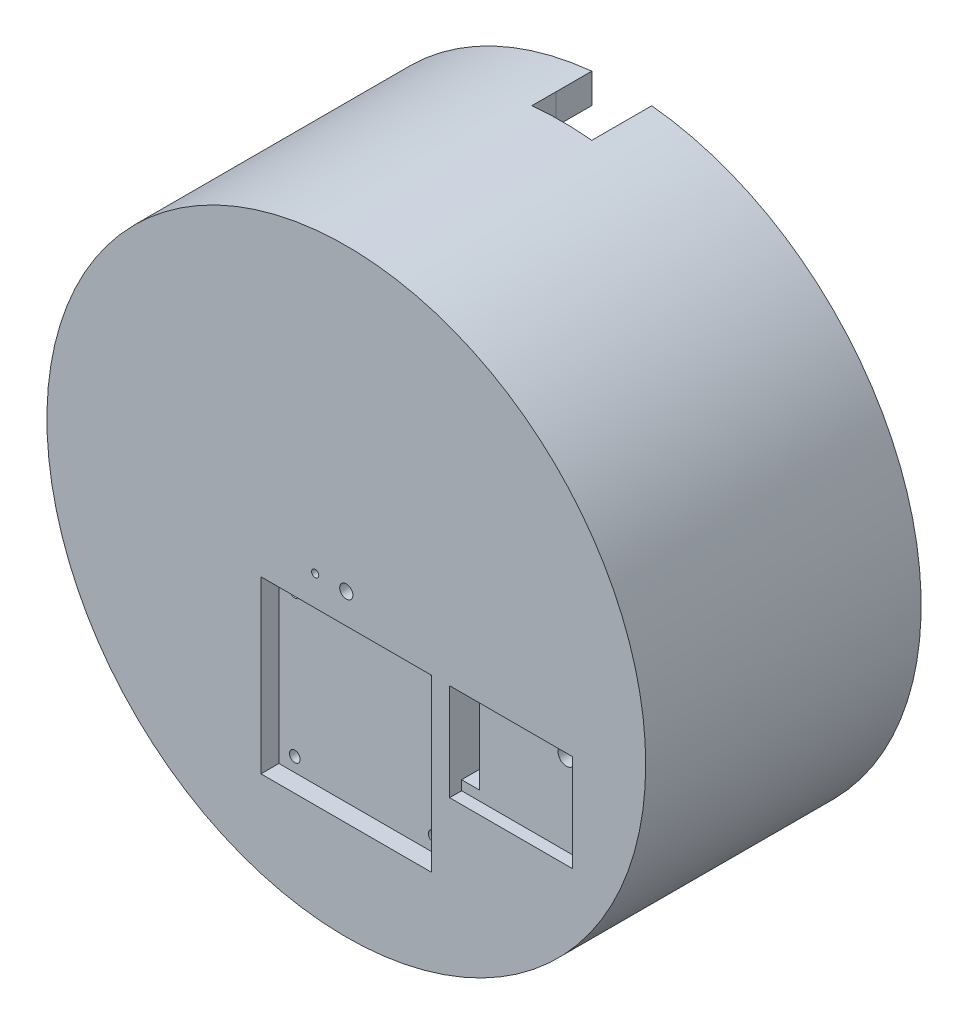
from build123d import *

# Parameters (mm, degrees)
SKETCH_1_R                = 50
EXTRUDE_1_DEPTH           = 50
SKETCH_2_R                = 45
CUT_EXTRUDE_1_DEPTH       = 10
SKETCH_3_R                = 39
CUT_EXTRUDE_2_DEPTH       = 30
SKETCH_4_R                = 1.05
CUT_EXTRUDE_3_DEPTH       = 87.602540378
SKETCH_5_R                = 0.6
CUT_EXTRUDE_4_DEPTH       = 87.602540378
SKETCH_7_W                = 28.5
SKETCH_7_H                = 28.5
CUT_EXTRUDE_5_DEPTH       = 3
SKETCH_8_R                = 0.9
SKETCH_8_W                = 18.2
SKETCH_8_H                = 2.6
CUT_EXTRUDE_6_DEPTH       = 85.905830189
SKETCH_9_W                = 20.5
SKETCH_9_H                = 16.2
CUT_EXTRUDE_7_DEPTH       = 2
SKETCH_10_R               = 1.4
SKETCH_10_W               = 3
SKETCH_10_H               = 13
CUT_EXTRUDE_8_DEPTH       = 86.463442477
SKETCH_11_R               = 1.1
CUT_EXTRUDE_9_DEPTH       = 87.602540378
SKETCH_12_R               = 1.45
CUT_EXTRUDE_11_DEPTH      = 5
SKETCH_13_W               = 10
SKETCH_13_H               = 10
CUT_EXTRUDE_12_DEPTH      = 10
SKETCH_14_W               = 10.013000588
SKETCH_14_H               = 15.501695623
CUT_EXTRUDE_14_DEPTH      = 4
SKETCH_15_R               = 45.05
CUT_EXTRUDE_15_DEPTH      = 10
CUT_EXTRUDE_16_DEPTH      = 90.582364336
CUT_EXTRUDE_16_DEPTH_BACK = 90.582364336
SKETCH_16_W               = 4
SKETCH_16_H               = 105.289342961


with BuildPart() as part:
    # 草图1 → 凸台-拉伸1 (new body)
    with BuildSketch(Plane.XY):
        Circle(SKETCH_1_R)
    extrude(amount=EXTRUDE_1_DEPTH)

    # 草图2 → 切除-拉伸1 (cut)
    with BuildSketch(Plane(origin=(0, 0, 0), x_dir=(-1, 0, 0), z_dir=(0, 0, -1))):
        Circle(SKETCH_2_R)
    extrude(amount=-CUT_EXTRUDE_1_DEPTH, mode=Mode.SUBTRACT)

    # 草图3 → 切除-拉伸2 (cut)
    with BuildSketch(Plane(origin=(0, 0, 10), x_dir=(-1, 0, 0), z_dir=(0, 0, -1))):
        Circle(SKETCH_3_R)
    extrude(amount=-CUT_EXTRUDE_2_DEPTH, mode=Mode.SUBTRACT)

    # 草图4 → 切除-拉伸3 (cut, through all)
    with BuildSketch(Plane.XY.offset(50)):
        Circle(SKETCH_4_R)
    extrude(amount=-CUT_EXTRUDE_3_DEPTH, mode=Mode.SUBTRACT)

    # 草图5 → 切除-拉伸4 (cut, through all)
    with BuildSketch(Plane.XY.offset(50)):
        with Locations((-5.2, 0)):
            Circle(SKETCH_5_R)
    extrude(amount=-CUT_EXTRUDE_4_DEPTH, mode=Mode.SUBTRACT)

    # 草图7 → 切除-拉伸5 (cut)
    with BuildSketch(Plane.XY.offset(50)):
        with Locations((0, -19.25)):
            Rectangle(SKETCH_7_W, SKETCH_7_H)
    extrude(amount=-CUT_EXTRUDE_5_DEPTH, mode=Mode.SUBTRACT)

    # 草图8 → 切除-拉伸6 (cut, through all)
    with BuildSketch(Plane.XY.offset(47)):
        with Locations((-11.6, -7.35)):
            Circle(SKETCH_8_R)
        with Locations((11.6, -7.35)):
            Circle(SKETCH_8_R)
        with Locations((-11.6, -31.15)):
            Circle(SKETCH_8_R)
        with Locations((11.6, -31.15)):
            Circle(SKETCH_8_R)
        with Locations((0, -6.3)):
            Rectangle(SKETCH_8_W, SKETCH_8_H)
    extrude(amount=-CUT_EXTRUDE_6_DEPTH, mode=Mode.SUBTRACT)

    # 草图9 → 切除-拉伸7 (cut)
    with BuildSketch(Plane.XY.offset(50)):
        with Locations((27.5, -13.1)):
            Rectangle(SKETCH_9_W, SKETCH_9_H)
    extrude(amount=-CUT_EXTRUDE_7_DEPTH, mode=Mode.SUBTRACT)

    # 草图10 → 切除-拉伸8 (cut, through all)
    with BuildSketch(Plane.XY.offset(48)):
        with Locations((34.75, -7.5)):
            Circle(SKETCH_10_R)
        with Locations((18.75, -13.1)):
            Rectangle(SKETCH_10_W, SKETCH_10_H)
    extrude(amount=-CUT_EXTRUDE_8_DEPTH, mode=Mode.SUBTRACT)

    # 草图11 → 切除-拉伸9 (cut, through all)
    with BuildSketch(Plane.XY.offset(50)):
        Circle(SKETCH_11_R)
    extrude(amount=-CUT_EXTRUDE_9_DEPTH, mode=Mode.SUBTRACT)

    # 草图12 → 切除-拉伸11 (cut)
    with BuildSketch(Plane(origin=(0, 0, 10), x_dir=(-1, 0, 0), z_dir=(0, 0, -1))):
        with Locations((42, 0)):
            Circle(SKETCH_12_R)
        with Locations((-42, 0)):
            Circle(SKETCH_12_R)
        with Locations((0, -42)):
            Circle(SKETCH_12_R)
    extrude(amount=-CUT_EXTRUDE_11_DEPTH, mode=Mode.SUBTRACT)

    # 草图13 → 切除-拉伸12 (cut)
    with BuildSketch(Plane(origin=(0, 0, 0), x_dir=(-1, 0, 0), z_dir=(0, 0, -1))):
        with Locations((0, 49.72135955)):
            Rectangle(SKETCH_13_W, SKETCH_13_H)
    extrude(amount=-CUT_EXTRUDE_12_DEPTH, mode=Mode.SUBTRACT)

    # 草图14 → 切除-拉伸14 (cut)
    with BuildSketch(Plane(origin=(0, 0, 10), x_dir=(-1, 0, 0), z_dir=(0, 0, -1))):
        with Locations((0.006500294, 43.751614386)):
            Rectangle(SKETCH_14_W, SKETCH_14_H)
    extrude(amount=-CUT_EXTRUDE_14_DEPTH, mode=Mode.SUBTRACT)

    # 草图15 → 切除-拉伸15 (cut)
    with BuildSketch(Plane(origin=(0, 0, 0), x_dir=(-1, 0, 0), z_dir=(0, 0, -1))):
        Circle(SKETCH_15_R)
    extrude(amount=-CUT_EXTRUDE_15_DEPTH, mode=Mode.SUBTRACT)

    # 草图16 → 切除-拉伸16 (cut, two sides: drawn at the far end of the back side and taken through both)
    with BuildSketch(Plane.ZY.offset(-5).offset(-CUT_EXTRUDE_16_DEPTH_BACK)):
        with Locations((2, -2.895299626)):
            Rectangle(SKETCH_16_W, SKETCH_16_H)
    extrude(amount=CUT_EXTRUDE_16_DEPTH + CUT_EXTRUDE_16_DEPTH_BACK, mode=Mode.SUBTRACT)


solid = part.part
